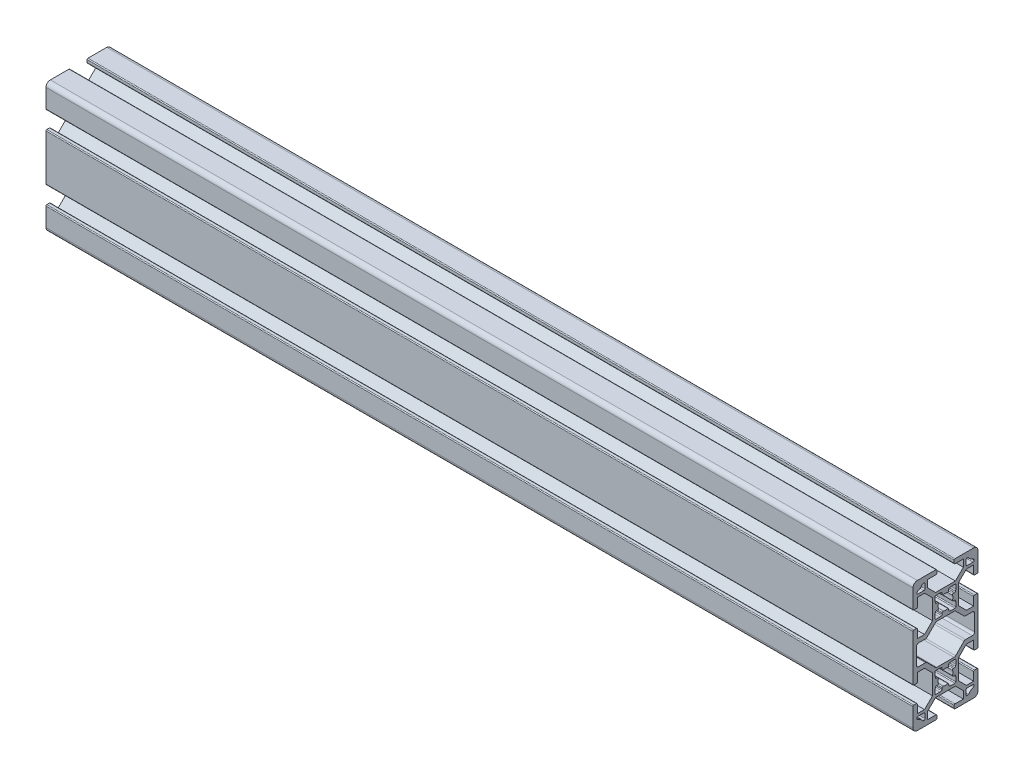
from build123d import *

# Parameters (mm, degrees)
BOSS_EXTRUDE1_DEPTH = 400


with BuildPart() as part:
    # Sketch1 → Boss-Extrude1 (new body)
    with BuildSketch(Plane(origin=(0, 0, 0), x_dir=(0, 0, -1), z_dir=(1, 0, 0))):
        with BuildLine():
            Line((-15, -19.4), (-15, -28))
            ThreePointArc((-15, -28), (-14.414213562, -29.414213562), (-13, -30))
            Line((-13, -30), (-4.4, -30))
            ThreePointArc((-4.4, -30), (-4.117157288, -29.882842712), (-4, -29.6))
            Line((-4, -29.6), (-4, -28.4))
            ThreePointArc((-4, -28.4), (-4.117157288, -28.117157288), (-4.4, -28))
            Line((-4.4, -28), (-8.25, -28))
            Line((-8.25, -28), (-8.25, -24.664213562))
            Line((-8.25, -24.664213562), (-4.585786438, -21))
            Line((-4.585786438, -21), (4.585786438, -21))
            Line((4.585786438, -21), (8.25, -24.664213562))
            Line((8.25, -24.664213562), (8.25, -28))
            Line((8.25, -28), (4.4, -28))
            ThreePointArc((4.4, -28), (4.117157288, -28.117157288), (4, -28.4))
            Line((4, -28.4), (4, -29.6))
            ThreePointArc((4, -29.6), (4.117157288, -29.882842712), (4.4, -30))
            Line((4.4, -30), (13, -30))
            ThreePointArc((13, -30), (14.414213562, -29.414213562), (15, -28))
            Line((15, -28), (15, -19.4))
            ThreePointArc((15, -19.4), (14.882842712, -19.117157288), (14.6, -19))
            Line((14.6, -19), (13.4, -19))
            ThreePointArc((13.4, -19), (13.117157288, -19.117157288), (13, -19.4))
            Line((13, -19.4), (13, -23.25))
            Line((13, -23.25), (9.664213562, -23.25))
            Line((9.664213562, -23.25), (6, -19.585786438))
            Line((6, -19.585786438), (6, -10.414213562))
            Line((6, -10.414213562), (9.664213562, -6.75))
            Line((9.664213562, -6.75), (13, -6.75))
            Line((13, -6.75), (13, -10.6))
            ThreePointArc((13, -10.6), (13.117157288, -10.882842712), (13.4, -11))
            Line((13.4, -11), (14.6, -11))
            ThreePointArc((14.6, -11), (14.882842712, -10.882842712), (15, -10.6))
            Line((15, -10.6), (15, 10.6))
            ThreePointArc((15, 10.6), (14.882842712, 10.882842712), (14.6, 11))
            Line((14.6, 11), (13.4, 11))
            ThreePointArc((13.4, 11), (13.117157288, 10.882842712), (13, 10.6))
            Line((13, 10.6), (13, 6.75))
            Line((13, 6.75), (9.664213562, 6.75))
            Line((9.664213562, 6.75), (6, 10.414213562))
            Line((6, 10.414213562), (6, 19.585786438))
            Line((6, 19.585786438), (9.664213562, 23.25))
            Line((9.664213562, 23.25), (13, 23.25))
            Line((13, 23.25), (13, 19.4))
            ThreePointArc((13, 19.4), (13.117157288, 19.117157288), (13.4, 19))
            Line((13.4, 19), (14.6, 19))
            ThreePointArc((14.6, 19), (14.882842712, 19.117157288), (15, 19.4))
            Line((15, 19.4), (15, 28))
            ThreePointArc((15, 28), (14.414213562, 29.414213562), (13, 30))
            Line((13, 30), (4.4, 30))
            ThreePointArc((4.4, 30), (4.117157288, 29.882842712), (4, 29.6))
            Line((4, 29.6), (4, 28.4))
            ThreePointArc((4, 28.4), (4.117157288, 28.117157288), (4.4, 28))
            Line((4.4, 28), (8.25, 28))
            Line((8.25, 28), (8.25, 24.664213562))
            Line((8.25, 24.664213562), (4.585786438, 21))
            Line((4.585786438, 21), (-4.585786438, 21))
            Line((-4.585786438, 21), (-8.25, 24.664213562))
            Line((-8.25, 24.664213562), (-8.25, 28))
            Line((-8.25, 28), (-4.4, 28))
            ThreePointArc((-4.4, 28), (-4.117157288, 28.117157288), (-4, 28.4))
            Line((-4, 28.4), (-4, 29.6))
            ThreePointArc((-4, 29.6), (-4.117157288, 29.882842712), (-4.4, 30))
            Line((-4.4, 30), (-13, 30))
            ThreePointArc((-13, 30), (-14.414213562, 29.414213562), (-15, 28))
            Line((-15, 28), (-15, 19.4))
            ThreePointArc((-15, 19.4), (-14.882842712, 19.117157288), (-14.6, 19))
            Line((-14.6, 19), (-13.4, 19))
            ThreePointArc((-13.4, 19), (-13.117157288, 19.117157288), (-13, 19.4))
            Line((-13, 19.4), (-13, 23.25))
            Line((-13, 23.25), (-9.664213562, 23.25))
            Line((-9.664213562, 23.25), (-6, 19.585786438))
            Line((-6, 19.585786438), (-6, 10.414213562))
            Line((-6, 10.414213562), (-9.664213562, 6.75))
            Line((-9.664213562, 6.75), (-13, 6.75))
            Line((-13, 6.75), (-13, 10.6))
            ThreePointArc((-13, 10.6), (-13.117157288, 10.882842712), (-13.4, 11))
            Line((-13.4, 11), (-14.6, 11))
            ThreePointArc((-14.6, 11), (-14.882842712, 10.882842712), (-15, 10.6))
            Line((-15, 10.6), (-15, -10.6))
            ThreePointArc((-15, -10.6), (-14.882842712, -10.882842712), (-14.6, -11))
            Line((-14.6, -11), (-13.4, -11))
            ThreePointArc((-13.4, -11), (-13.117157288, -10.882842712), (-13, -10.6))
            Line((-13, -10.6), (-13, -6.75))
            Line((-13, -6.75), (-9.664213562, -6.75))
            Line((-9.664213562, -6.75), (-6, -10.414213562))
            Line((-6, -10.414213562), (-6, -19.585786438))
            Line((-6, -19.585786438), (-9.664213562, -23.25))
            Line((-9.664213562, -23.25), (-13, -23.25))
            Line((-13, -23.25), (-13, -19.4))
            ThreePointArc((-13, -19.4), (-13.117157288, -19.117157288), (-13.4, -19))
            Line((-13.4, -19), (-14.6, -19))
            ThreePointArc((-14.6, -19), (-14.882842712, -19.117157288), (-15, -19.4))
        make_face()
        with BuildLine():
            Line((-13.2, 25.115022568), (-13.2, 24.95))
            ThreePointArc((-13.2, 24.95), (-13.053553391, 24.596446609), (-12.7, 24.45))
            Line((-12.7, 24.45), (-9.95, 24.45))
            ThreePointArc((-9.95, 24.45), (-9.596446609, 24.596446609), (-9.45, 24.95))
            Line((-9.45, 24.95), (-9.45, 27))
            ThreePointArc((-9.45, 27), (-9.596446609, 27.353553391), (-9.95, 27.5))
            Line((-9.95, 27.5), (-10.201162948, 27.5))
            ThreePointArc((-10.201162948, 27.5), (-10.428949674, 27.445099099), (-10.606713613, 27.29245283))
            ThreePointArc((-10.606713613, 27.29245283), (-11.609362709, 26.268001037), (-12.869811321, 25.585303458))
            ThreePointArc((-12.869811321, 25.585303458), (-13.109210007, 25.4023328), (-13.2, 25.115022568))
        make_face(mode=Mode.SUBTRACT)
        with BuildLine():
            Line((9.45, 27), (9.45, 24.95))
            ThreePointArc((9.45, 24.95), (9.596446609, 24.596446609), (9.95, 24.45))
            Line((9.95, 24.45), (12.7, 24.45))
            ThreePointArc((12.7, 24.45), (13.053553391, 24.596446609), (13.2, 24.95))
            Line((13.2, 24.95), (13.2, 25.115022568))
            ThreePointArc((13.2, 25.115022568), (13.109210007, 25.4023328), (12.869811321, 25.585303458))
            ThreePointArc((12.869811321, 25.585303458), (11.609362709, 26.268001037), (10.606713613, 27.29245283))
            ThreePointArc((10.606713613, 27.29245283), (10.428949674, 27.445099099), (10.201162948, 27.5))
            Line((10.201162948, 27.5), (9.95, 27.5))
            ThreePointArc((9.95, 27.5), (9.596446609, 27.353553391), (9.45, 27))
        make_face(mode=Mode.SUBTRACT)
        with BuildLine():
            Line((-9.95, -24.45), (-12.7, -24.45))
            ThreePointArc((-12.7, -24.45), (-13.053553391, -24.596446609), (-13.2, -24.95))
            Line((-13.2, -24.95), (-13.2, -25.115022568))
            ThreePointArc((-13.2, -25.115022568), (-13.109210007, -25.4023328), (-12.869811321, -25.585303458))
            ThreePointArc((-12.869811321, -25.585303458), (-11.609362709, -26.268001037), (-10.606713613, -27.29245283))
            ThreePointArc((-10.606713613, -27.29245283), (-10.428949674, -27.445099099), (-10.201162948, -27.5))
            Line((-10.201162948, -27.5), (-9.95, -27.5))
            ThreePointArc((-9.95, -27.5), (-9.596446609, -27.353553391), (-9.45, -27))
            Line((-9.45, -27), (-9.45, -24.95))
            ThreePointArc((-9.45, -24.95), (-9.596446609, -24.596446609), (-9.95, -24.45))
        make_face(mode=Mode.SUBTRACT)
        with BuildLine():
            Line((-4.8, 19.4), (-4.8, 17.662238167))
            ThreePointArc((-4.8, 17.662238167), (-4.798158479, 17.623899866), (-4.792650873, 17.585914569))
            Line((-4.792650873, 17.585914569), (-4.644486783, 16.823676402))
            ThreePointArc((-4.644486783, 16.823676402), (-4.506267197, 16.591350167), (-4.251835909, 16.5))
            Line((-4.251835909, 16.5), (-3.637306696, 16.5))
            ThreePointArc((-3.637306696, 16.5), (-3.316124668, 16.338415824), (-3.254432307, 15.984210526))
            ThreePointArc((-3.254432307, 15.984210526), (-3.4, 15), (-3.254432307, 14.015789474))
            ThreePointArc((-3.254432307, 14.015789474), (-3.316124668, 13.661584176), (-3.637306696, 13.5))
            Line((-3.637306696, 13.5), (-4.251835909, 13.5))
            ThreePointArc((-4.251835909, 13.5), (-4.506267197, 13.408649833), (-4.644486783, 13.176323598))
            Line((-4.644486783, 13.176323598), (-4.792650873, 12.414085431))
            ThreePointArc((-4.792650873, 12.414085431), (-4.798158479, 12.376100134), (-4.8, 12.337761833))
            Line((-4.8, 12.337761833), (-4.8, 10.6))
            ThreePointArc((-4.8, 10.6), (-4.682842712, 10.317157288), (-4.4, 10.2))
            Line((-4.4, 10.2), (-2.662238167, 10.2))
            ThreePointArc((-2.662238167, 10.2), (-2.623899866, 10.201841521), (-2.585914569, 10.207349127))
            Line((-2.585914569, 10.207349127), (-1.823676402, 10.355513217))
            ThreePointArc((-1.823676402, 10.355513217), (-1.591350167, 10.493732803), (-1.5, 10.748164091))
            Line((-1.5, 10.748164091), (-1.5, 11.362693304))
            ThreePointArc((-1.5, 11.362693304), (-1.338415824, 11.683875332), (-0.984210526, 11.745567693))
            ThreePointArc((-0.984210526, 11.745567693), (0, 11.6), (0.984210526, 11.745567693))
            ThreePointArc((0.984210526, 11.745567693), (1.338415824, 11.683875332), (1.5, 11.362693304))
            Line((1.5, 11.362693304), (1.5, 10.748164091))
            ThreePointArc((1.5, 10.748164091), (1.591350167, 10.493732803), (1.823676402, 10.355513217))
            Line((1.823676402, 10.355513217), (2.585914569, 10.207349127))
            ThreePointArc((2.585914569, 10.207349127), (2.623899866, 10.201841521), (2.662238167, 10.2))
            Line((2.662238167, 10.2), (4.4, 10.2))
            ThreePointArc((4.4, 10.2), (4.682842712, 10.317157288), (4.8, 10.6))
            Line((4.8, 10.6), (4.8, 12.337761833))
            ThreePointArc((4.8, 12.337761833), (4.798158479, 12.376100134), (4.792650873, 12.414085431))
            Line((4.792650873, 12.414085431), (4.644486783, 13.176323598))
            ThreePointArc((4.644486783, 13.176323598), (4.506267197, 13.408649833), (4.251835909, 13.5))
            Line((4.251835909, 13.5), (3.637306696, 13.5))
            ThreePointArc((3.637306696, 13.5), (3.316124668, 13.661584176), (3.254432307, 14.015789474))
            ThreePointArc((3.254432307, 14.015789474), (3.4, 15), (3.254432307, 15.984210526))
            ThreePointArc((3.254432307, 15.984210526), (3.316124668, 16.338415824), (3.637306696, 16.5))
            Line((3.637306696, 16.5), (4.251835909, 16.5))
            ThreePointArc((4.251835909, 16.5), (4.506267197, 16.591350167), (4.644486783, 16.823676402))
            Line((4.644486783, 16.823676402), (4.792650873, 17.585914569))
            ThreePointArc((4.792650873, 17.585914569), (4.798158479, 17.623899866), (4.8, 17.662238167))
            Line((4.8, 17.662238167), (4.8, 19.4))
            ThreePointArc((4.8, 19.4), (4.682842712, 19.682842712), (4.4, 19.8))
            Line((4.4, 19.8), (2.662238167, 19.8))
            ThreePointArc((2.662238167, 19.8), (2.623899866, 19.798158479), (2.585914569, 19.792650873))
            Line((2.585914569, 19.792650873), (1.823676402, 19.644486783))
            ThreePointArc((1.823676402, 19.644486783), (1.591350167, 19.506267197), (1.5, 19.251835909))
            Line((1.5, 19.251835909), (1.5, 18.637306696))
            ThreePointArc((1.5, 18.637306696), (1.338415824, 18.316124668), (0.984210526, 18.254432307))
            ThreePointArc((0.984210526, 18.254432307), (0, 18.4), (-0.984210526, 18.254432307))
            ThreePointArc((-0.984210526, 18.254432307), (-1.338415824, 18.316124668), (-1.5, 18.637306696))
            Line((-1.5, 18.637306696), (-1.5, 19.251835909))
            ThreePointArc((-1.5, 19.251835909), (-1.591350167, 19.506267197), (-1.823676402, 19.644486783))
            Line((-1.823676402, 19.644486783), (-2.585914569, 19.792650873))
            ThreePointArc((-2.585914569, 19.792650873), (-2.623899866, 19.798158479), (-2.662238167, 19.8))
            Line((-2.662238167, 19.8), (-4.4, 19.8))
            ThreePointArc((-4.4, 19.8), (-4.682842712, 19.682842712), (-4.8, 19.4))
        make_face(mode=Mode.SUBTRACT)
        with BuildLine():
            Line((-13.4, 3.75), (-13.4, -3.75))
            ThreePointArc((-13.4, -3.75), (-13.107106781, -4.457106781), (-12.4, -4.75))
            Line((-12.4, -4.75), (-9.25, -4.75))
            ThreePointArc((-9.25, -4.75), (-8.867316568, -4.826120467), (-8.542893219, -5.042893219))
            Line((-8.542893219, -5.042893219), (-4.678679656, -8.907106781))
            ThreePointArc((-4.678679656, -8.907106781), (-4.354256308, -9.123879533), (-3.971572875, -9.2))
            Line((-3.971572875, -9.2), (3.971572875, -9.2))
            ThreePointArc((3.971572875, -9.2), (4.354256308, -9.123879533), (4.678679656, -8.907106781))
            Line((4.678679656, -8.907106781), (8.542893219, -5.042893219))
            ThreePointArc((8.542893219, -5.042893219), (8.867316568, -4.826120467), (9.25, -4.75))
            Line((9.25, -4.75), (12.4, -4.75))
            ThreePointArc((12.4, -4.75), (13.107106781, -4.457106781), (13.4, -3.75))
            Line((13.4, -3.75), (13.4, 3.75))
            ThreePointArc((13.4, 3.75), (13.107106781, 4.457106781), (12.4, 4.75))
            Line((12.4, 4.75), (9.25, 4.75))
            ThreePointArc((9.25, 4.75), (8.867316568, 4.826120467), (8.542893219, 5.042893219))
            Line((8.542893219, 5.042893219), (4.678679656, 8.907106781))
            ThreePointArc((4.678679656, 8.907106781), (4.354256308, 9.123879533), (3.971572875, 9.2))
            Line((3.971572875, 9.2), (-3.971572875, 9.2))
            ThreePointArc((-3.971572875, 9.2), (-4.354256308, 9.123879533), (-4.678679656, 8.907106781))
            Line((-4.678679656, 8.907106781), (-8.542893219, 5.042893219))
            ThreePointArc((-8.542893219, 5.042893219), (-8.867316568, 4.826120467), (-9.25, 4.75))
            Line((-9.25, 4.75), (-12.4, 4.75))
            ThreePointArc((-12.4, 4.75), (-13.107106781, 4.457106781), (-13.4, 3.75))
        make_face(mode=Mode.SUBTRACT)
        with BuildLine():
            Line((12.7, -24.45), (9.95, -24.45))
            ThreePointArc((9.95, -24.45), (9.596446609, -24.596446609), (9.45, -24.95))
            Line((9.45, -24.95), (9.45, -27))
            ThreePointArc((9.45, -27), (9.596446609, -27.353553391), (9.95, -27.5))
            Line((9.95, -27.5), (10.201162948, -27.5))
            ThreePointArc((10.201162948, -27.5), (10.428949674, -27.445099099), (10.606713613, -27.29245283))
            ThreePointArc((10.606713613, -27.29245283), (11.609362709, -26.268001037), (12.869811321, -25.585303458))
            ThreePointArc((12.869811321, -25.585303458), (13.109210007, -25.4023328), (13.2, -25.115022568))
            Line((13.2, -25.115022568), (13.2, -24.95))
            ThreePointArc((13.2, -24.95), (13.053553391, -24.596446609), (12.7, -24.45))
        make_face(mode=Mode.SUBTRACT)
        with BuildLine():
            Line((-4.8, -17.662238167), (-4.8, -19.4))
            ThreePointArc((-4.8, -19.4), (-4.682842712, -19.682842712), (-4.4, -19.8))
            Line((-4.4, -19.8), (-2.662238167, -19.8))
            ThreePointArc((-2.662238167, -19.8), (-2.623899866, -19.798158479), (-2.585914569, -19.792650873))
            Line((-2.585914569, -19.792650873), (-1.823676402, -19.644486783))
            ThreePointArc((-1.823676402, -19.644486783), (-1.591350167, -19.506267197), (-1.5, -19.251835909))
            Line((-1.5, -19.251835909), (-1.5, -18.637306696))
            ThreePointArc((-1.5, -18.637306696), (-1.338415824, -18.316124668), (-0.984210526, -18.254432307))
            ThreePointArc((-0.984210526, -18.254432307), (0, -18.4), (0.984210526, -18.254432307))
            ThreePointArc((0.984210526, -18.254432307), (1.338415824, -18.316124668), (1.5, -18.637306696))
            Line((1.5, -18.637306696), (1.5, -19.251835909))
            ThreePointArc((1.5, -19.251835909), (1.591350167, -19.506267197), (1.823676402, -19.644486783))
            Line((1.823676402, -19.644486783), (2.585914569, -19.792650873))
            ThreePointArc((2.585914569, -19.792650873), (2.623899866, -19.798158479), (2.662238167, -19.8))
            Line((2.662238167, -19.8), (4.4, -19.8))
            ThreePointArc((4.4, -19.8), (4.682842712, -19.682842712), (4.8, -19.4))
            Line((4.8, -19.4), (4.8, -17.662238167))
            ThreePointArc((4.8, -17.662238167), (4.798158479, -17.623899866), (4.792650873, -17.585914569))
            Line((4.792650873, -17.585914569), (4.644486783, -16.823676402))
            ThreePointArc((4.644486783, -16.823676402), (4.506267197, -16.591350167), (4.251835909, -16.5))
            Line((4.251835909, -16.5), (3.637306696, -16.5))
            ThreePointArc((3.637306696, -16.5), (3.316124668, -16.338415824), (3.254432307, -15.984210526))
            ThreePointArc((3.254432307, -15.984210526), (3.4, -15), (3.254432307, -14.015789474))
            ThreePointArc((3.254432307, -14.015789474), (3.316124668, -13.661584176), (3.637306696, -13.5))
            Line((3.637306696, -13.5), (4.251835909, -13.5))
            ThreePointArc((4.251835909, -13.5), (4.506267197, -13.408649833), (4.644486783, -13.176323598))
            Line((4.644486783, -13.176323598), (4.792650873, -12.414085431))
            ThreePointArc((4.792650873, -12.414085431), (4.798158479, -12.376100134), (4.8, -12.337761833))
            Line((4.8, -12.337761833), (4.8, -10.6))
            ThreePointArc((4.8, -10.6), (4.682842712, -10.317157288), (4.4, -10.2))
            Line((4.4, -10.2), (2.662238167, -10.2))
            ThreePointArc((2.662238167, -10.2), (2.623899866, -10.201841521), (2.585914569, -10.207349127))
            Line((2.585914569, -10.207349127), (1.823676402, -10.355513217))
            ThreePointArc((1.823676402, -10.355513217), (1.591350167, -10.493732803), (1.5, -10.748164091))
            Line((1.5, -10.748164091), (1.5, -11.362693304))
            ThreePointArc((1.5, -11.362693304), (1.338415824, -11.683875332), (0.984210526, -11.745567693))
            ThreePointArc((0.984210526, -11.745567693), (0, -11.6), (-0.984210526, -11.745567693))
            ThreePointArc((-0.984210526, -11.745567693), (-1.338415824, -11.683875332), (-1.5, -11.362693304))
            Line((-1.5, -11.362693304), (-1.5, -10.748164091))
            ThreePointArc((-1.5, -10.748164091), (-1.591350167, -10.493732803), (-1.823676402, -10.355513217))
            Line((-1.823676402, -10.355513217), (-2.585914569, -10.207349127))
            ThreePointArc((-2.585914569, -10.207349127), (-2.623899866, -10.201841521), (-2.662238167, -10.2))
            Line((-2.662238167, -10.2), (-4.4, -10.2))
            ThreePointArc((-4.4, -10.2), (-4.682842712, -10.317157288), (-4.8, -10.6))
            Line((-4.8, -10.6), (-4.8, -12.337761833))
            ThreePointArc((-4.8, -12.337761833), (-4.798158479, -12.376100134), (-4.792650873, -12.414085431))
            Line((-4.792650873, -12.414085431), (-4.644486783, -13.176323598))
            ThreePointArc((-4.644486783, -13.176323598), (-4.506267197, -13.408649833), (-4.251835909, -13.5))
            Line((-4.251835909, -13.5), (-3.637306696, -13.5))
            ThreePointArc((-3.637306696, -13.5), (-3.316124668, -13.661584176), (-3.254432307, -14.015789474))
            ThreePointArc((-3.254432307, -14.015789474), (-3.4, -15), (-3.254432307, -15.984210526))
            ThreePointArc((-3.254432307, -15.984210526), (-3.316124668, -16.338415824), (-3.637306696, -16.5))
            Line((-3.637306696, -16.5), (-4.251835909, -16.5))
            ThreePointArc((-4.251835909, -16.5), (-4.506267197, -16.591350167), (-4.644486783, -16.823676402))
            Line((-4.644486783, -16.823676402), (-4.792650873, -17.585914569))
            ThreePointArc((-4.792650873, -17.585914569), (-4.798158479, -17.623899866), (-4.8, -17.662238167))
        make_face(mode=Mode.SUBTRACT)
    extrude(amount=BOSS_EXTRUDE1_DEPTH)


solid = part.part
